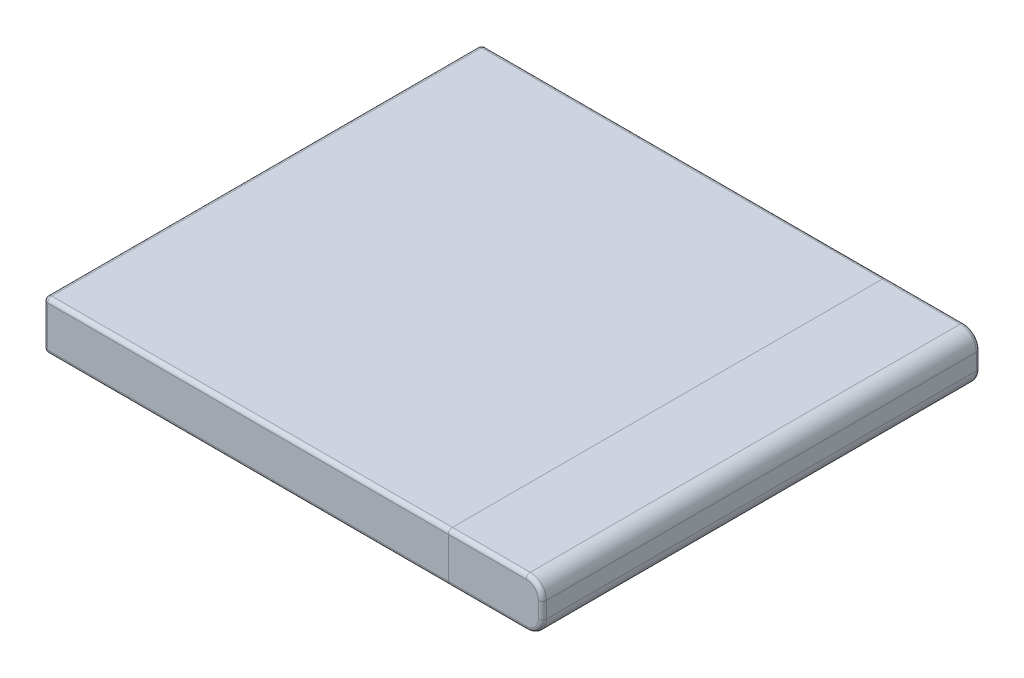
from build123d import *

# Parameters (mm, degrees)
BOSS_EXTRUDE1_DEPTH      = 3
BOSS_EXTRUDE1_DEPTH_BACK = 3
SKETCH1_W                = 49.9
SKETCH1_H                = 54
SKETCH4_W                = 54
SKETCH4_H                = 6
BOSS_EXTRUDE4_DEPTH      = 11.6
FILLET1_R                = 2
FILLET3_R                = 0.5
FILLET4_R                = 0.5


with BuildPart() as part:
    # Sketch1 → Boss-Extrude1 (new, two sides: drawn at the far end of the back side and taken through both)
    with BuildSketch(Plane(origin=(0, 0, 0), x_dir=(1, 0, 0), z_dir=(0, 1, 0)).offset(-BOSS_EXTRUDE1_DEPTH_BACK)):
        Rectangle(SKETCH1_W, SKETCH1_H)
    extrude(amount=BOSS_EXTRUDE1_DEPTH + BOSS_EXTRUDE1_DEPTH_BACK)

    # Fillet4
    fillet4_edges = [part.edges().sort_by_distance(p)[0] for p in [
        (-24.95, 0, 27),
        (-24.95, 3, 0),
        (-24.95, 0, -27),
        (-24.95, -3, 0),
        (0, -3, -27),
        (0, 3, -27),
        (0, -3, 27),
        (0, 3, 27),
    ]]
    fillet(fillet4_edges, radius=FILLET4_R)


with BuildPart() as body_2:
    # Sketch4 → Boss-Extrude4 (new body)
    with BuildSketch(Plane(origin=(24.95, 0, 0), x_dir=(0, 0, -1), z_dir=(1, 0, 0))):
        Rectangle(SKETCH4_W, SKETCH4_H)
    extrude(amount=BOSS_EXTRUDE4_DEPTH)

    # Fillet1
    fillet1_edges = [body_2.edges().sort_by_distance(p)[0] for p in [
        (36.55, -3, 0),
        (36.55, 3, 0),
    ]]
    fillet(fillet1_edges, radius=FILLET1_R)

    # Fillet3
    fillet3_edges = [body_2.edges().sort_by_distance(p)[0] for p in [
        (29.75, -3, 27),
        (35.964213562, -2.414213562, 27),
        (36.55, 0, 27),
        (35.964213562, 2.414213562, 27),
        (29.75, -3, -27),
        (35.964213562, -2.414213562, -27),
        (36.55, 0, -27),
        (35.964213562, 2.414213562, -27),
        (29.75, 3, 27),
        (29.75, 3, -27),
    ]]
    fillet(fillet3_edges, radius=FILLET3_R)


solid = Compound([part.part, body_2.part])
